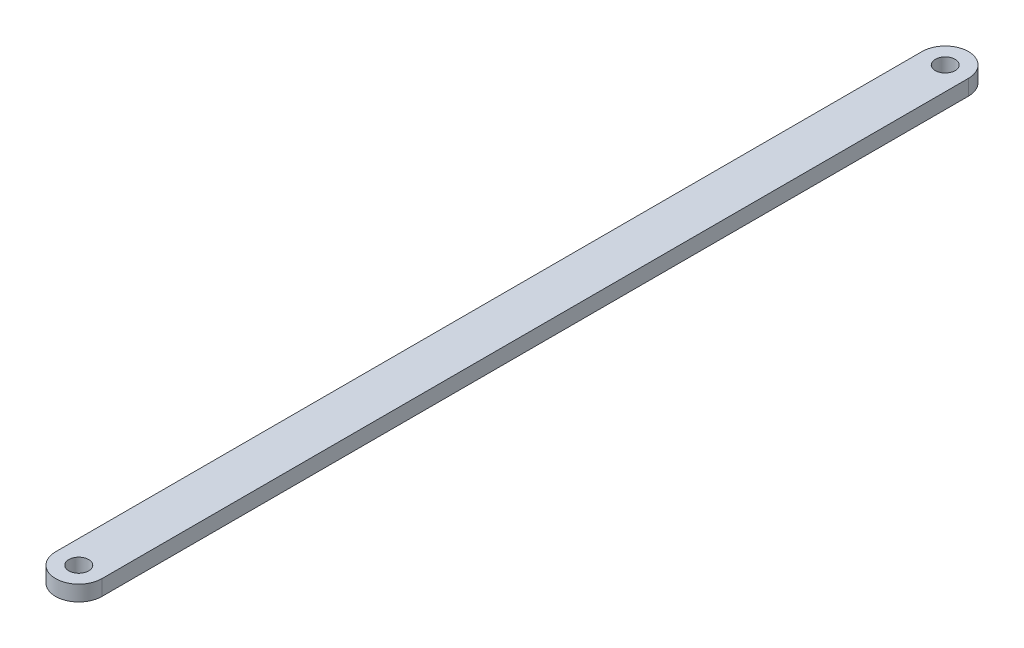
from build123d import *

# Parameters (mm, degrees)
SKETCH1_R           = 2.032
BOSS_EXTRUDE1_DEPTH = 3.175


with BuildPart() as part:
    # Sketch1 → Boss-Extrude1 (new body)
    with BuildSketch(Plane(origin=(0, 0, 0), x_dir=(1, 0, 0), z_dir=(0, 1, 0))):
        with BuildLine():
            Line((-4.7625, 0), (-4.7625, 177.8))
            ThreePointArc((-4.7625, 177.8), (0, 182.5625), (4.7625, 177.8))
            Line((4.7625, 177.8), (4.7625, 0))
            ThreePointArc((4.7625, 0), (0, -4.7625), (-4.7625, 0))
        make_face()
        with Locations(Location((0, 177.8, 0), (0, 0, 270))):
            Circle(SKETCH1_R, mode=Mode.SUBTRACT)
        with Locations(Location((0, 0, 0), (0, 0, 270))):
            Circle(SKETCH1_R, mode=Mode.SUBTRACT)
    extrude(amount=BOSS_EXTRUDE1_DEPTH)


solid = part.part
